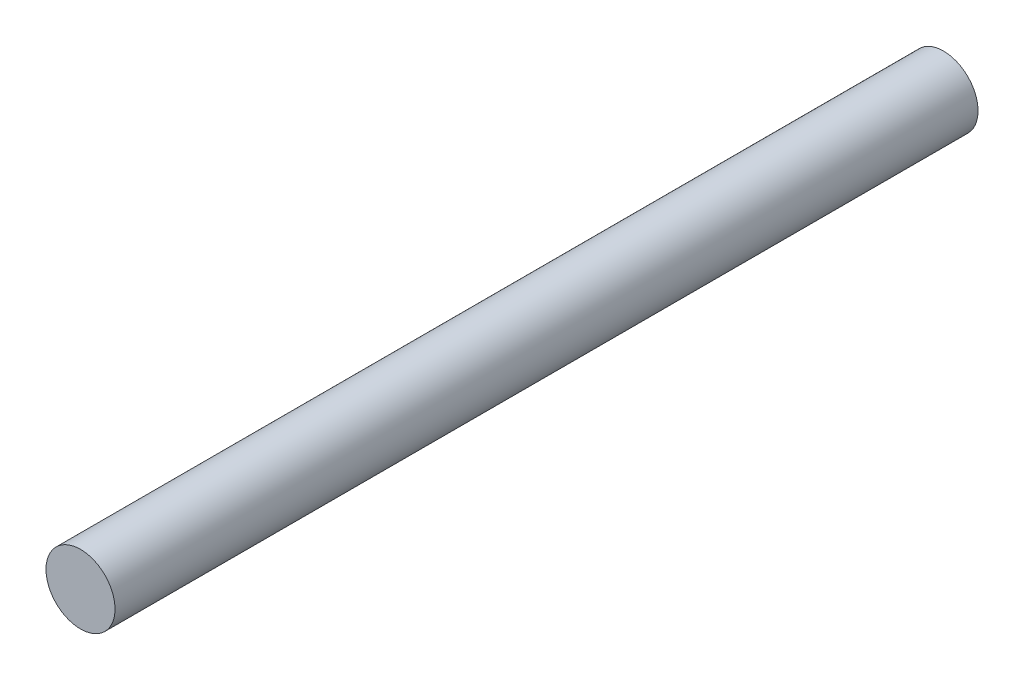
from build123d import *

# Parameters (mm, degrees)
SKETCH_1_W = 4
SKETCH_1_H = 100


with BuildPart() as part:
    # 草图1 → 旋转1 (revolve)
    with BuildSketch(Plane.XZ, mode=Mode.PRIVATE) as revolve_1_sk:
        with Locations((2, 0)):
            Rectangle(SKETCH_1_W, SKETCH_1_H)
    revolve(revolve_1_sk.sketch.rotate(Axis((0, 0, 50), (0, 0, -1)), 180), axis=Axis((0, 0, 50), (0, 0, -1)))


solid = part.part
